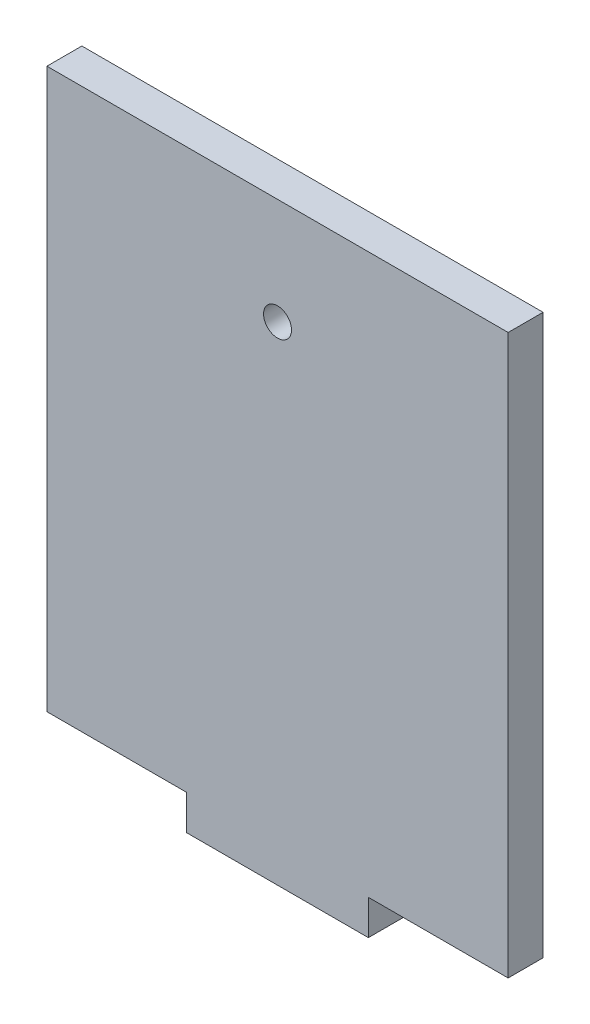
from build123d import *

# Parameters (mm, degrees)
BOSS_EXTRUDE1_DEPTH = 3.175
SKETCH3_R           = 1.27
CUT_EXTRUDE1_DEPTH  = 62.454091402


with BuildPart() as part:
    # Sketch2 → Boss-Extrude1 (new body)
    with BuildSketch(Plane.XY):
        Polygon((-16.51, 0), (0, 0), (0, 3.175), (12.7, 3.175), (12.7, 53.975), (-29.21, 53.975), (-29.21, 3.175), (-16.51, 3.175), align=None)
    extrude(amount=BOSS_EXTRUDE1_DEPTH)

    # Sketch3 → Cut-Extrude1 (cut, through all)
    with BuildSketch(Plane.XY.offset(3.175)):
        with Locations((-8.255, 44.323)):
            Circle(SKETCH3_R)
    extrude(amount=-CUT_EXTRUDE1_DEPTH, mode=Mode.SUBTRACT)


solid = part.part
